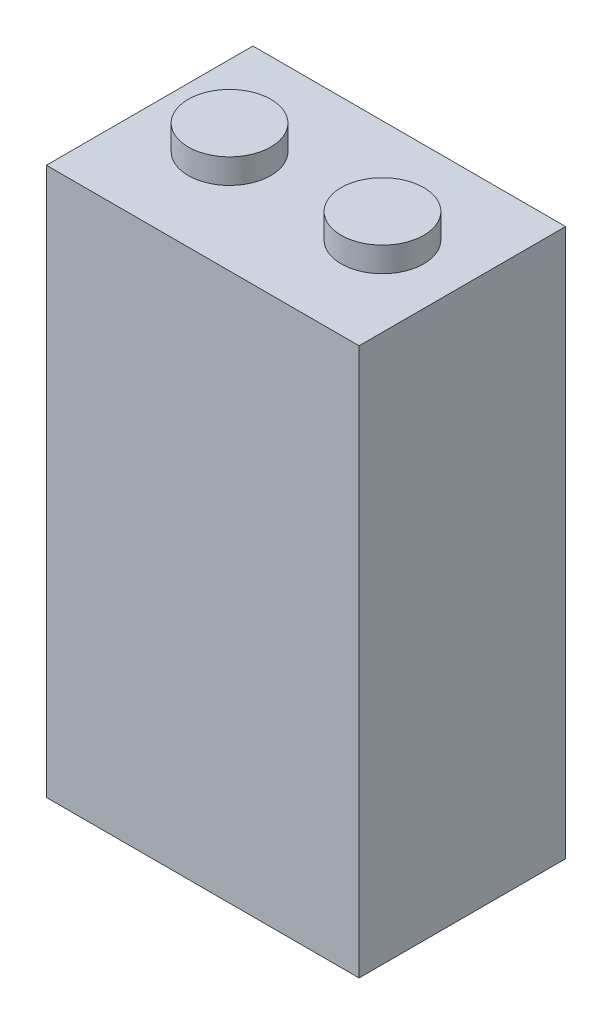
from build123d import *

# Parameters (mm, degrees)
SKETCH1_W           = 26.5
SKETCH1_H           = 17.5
BOSS_EXTRUDE1_DEPTH = 46.4
SKETCH2_R           = 3.5
BOSS_EXTRUDE2_DEPTH = 2.1


with BuildPart() as part:
    # Sketch1 → Boss-Extrude1 (new body)
    with BuildSketch(Plane(origin=(0, 0, 0), x_dir=(1, 0, 0), z_dir=(0, 1, 0))):
        Rectangle(SKETCH1_W, SKETCH1_H)
    extrude(amount=BOSS_EXTRUDE1_DEPTH)

    # Sketch2 → Boss-Extrude2 (add)
    with BuildSketch(Plane(origin=(0, 46.4, 0), x_dir=(1, 0, 0), z_dir=(0, 1, 0))):
        with Locations(Location((-6.48, 0, 0), (0, 0, 90))):
            Circle(SKETCH2_R)
        with Locations(Location((6.48, 0, 0), (0, 0, 90))):
            Circle(SKETCH2_R)
    extrude(amount=BOSS_EXTRUDE2_DEPTH)


solid = part.part
